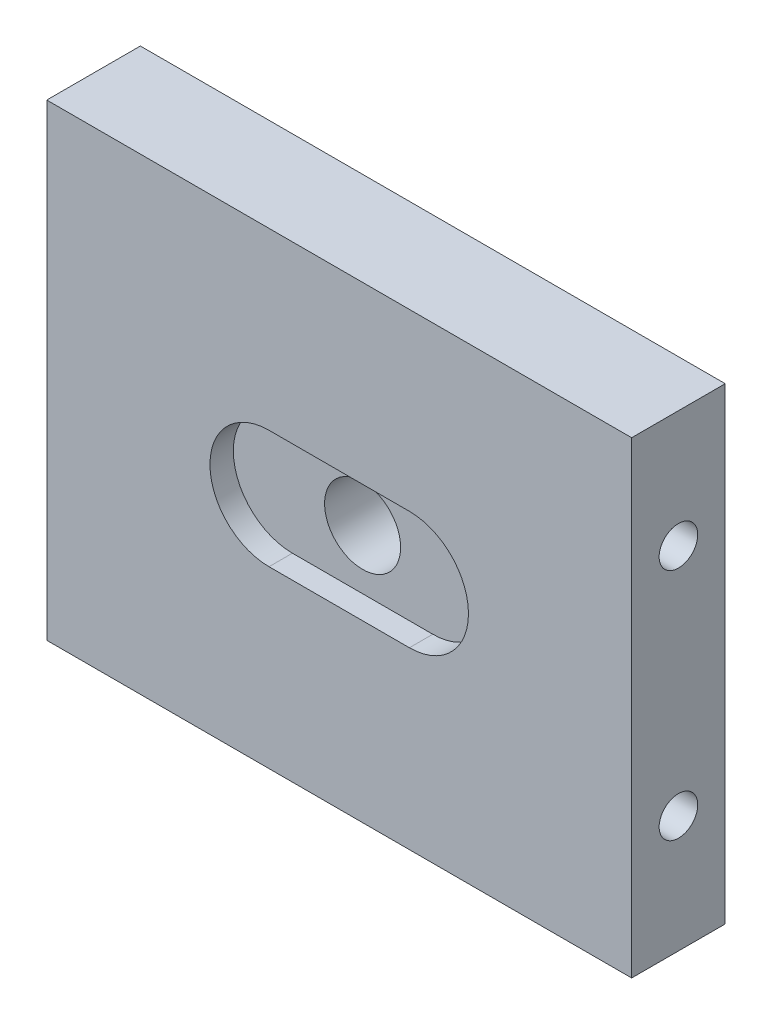
from build123d import *

# Parameters (mm, degrees)
SKETCH_1_W          = 50
SKETCH_1_H          = 40
EXTRUDE_1_DEPTH     = 8
CUT_EXTRUDE_1_DEPTH = 2
SKETCH_3_R          = 3.25
CUT_EXTRUDE_2_DEPTH = 10
SKETCH_4_R          = 1.65
CUT_EXTRUDE_3_DEPTH = 15


with BuildPart() as part:
    # Эскиз1 → Бобышка-Вытянуть1 (new body)
    with BuildSketch(Plane.XY):
        Rectangle(SKETCH_1_W, SKETCH_1_H)
    extrude(amount=EXTRUDE_1_DEPTH)

    # Эскиз2 → Вырез-Вытянуть1 (cut)
    with BuildSketch(Plane.XY.offset(8)):
        with BuildLine():
            Line((-6, 5.05), (6, 5.05))
            ThreePointArc((6, 5.05), (11.05, 0), (6, -5.05))
            Line((6, -5.05), (-6, -5.05))
            ThreePointArc((-6, -5.05), (-11.05, 0), (-6, 5.05))
        make_face()
    extrude(amount=-CUT_EXTRUDE_1_DEPTH, mode=Mode.SUBTRACT)

    # Эскиз3 → Вырез-Вытянуть2 (cut)
    with BuildSketch(Plane.XY.offset(6)):
        Circle(SKETCH_3_R)
    extrude(amount=-CUT_EXTRUDE_2_DEPTH, mode=Mode.SUBTRACT)

    # Эскиз4 → Вырез-Вытянуть3 (cut)
    with BuildSketch(Plane(origin=(25, 0, 0), x_dir=(0, 0, -1), z_dir=(1, 0, 0))):
        with Locations(Location((-4, -10, 0), (0, 0, 90))):
            Circle(SKETCH_4_R)
        with Locations(Location((-4, 10, 0), (0, 0, 90))):
            Circle(SKETCH_4_R)
    extrude(amount=-CUT_EXTRUDE_3_DEPTH, mode=Mode.SUBTRACT)


solid = part.part
